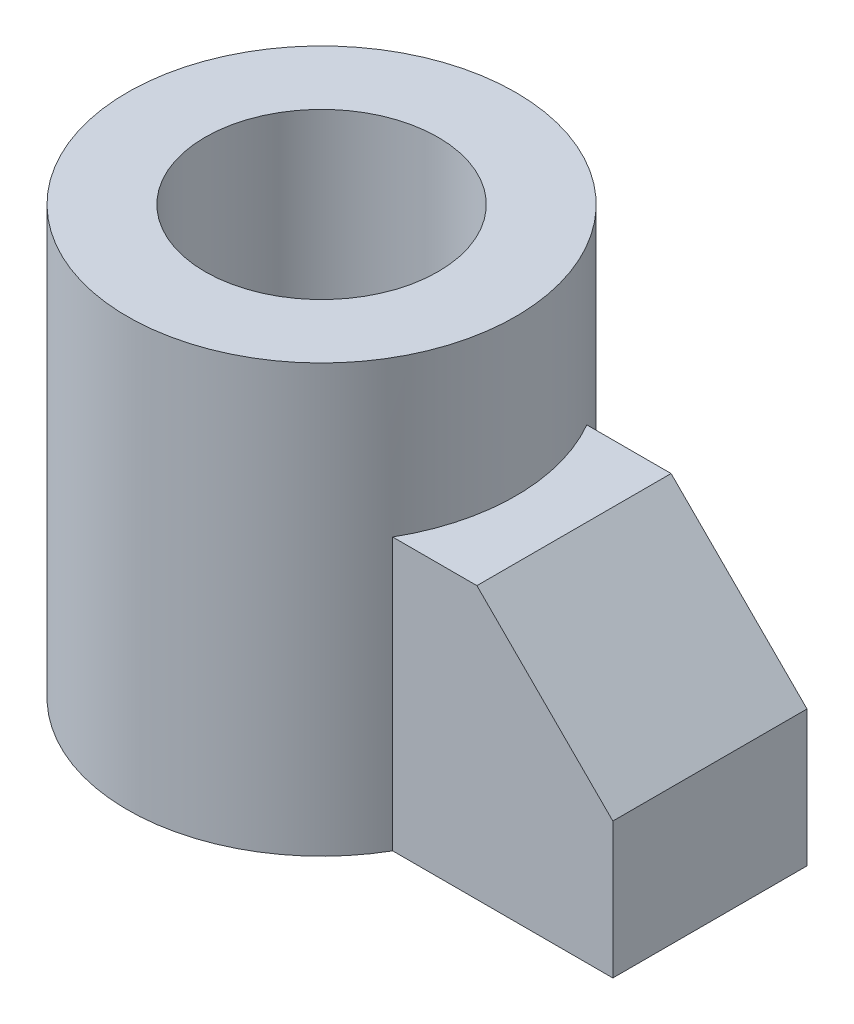
from build123d import *

# Parameters (mm, degrees)
SKETCH1_W           = 127
SKETCH1_H           = 63.5
BOSS_EXTRUDE1_DEPTH = 88.9
SKETCH3_R           = 63.5
BOSS_EXTRUDE2_DEPTH = 139.7
CUT_EXTRUDE1_REACH  = 213.465
CUT_EXTRUDE2_REACH  = 213.465
SKETCH5_R           = 38.1


with BuildPart() as part:
    # Sketch1 → Boss-Extrude1 (new body)
    with BuildSketch(Plane(origin=(0, 0, 0), x_dir=(1, 0, 0), z_dir=(0, 1, 0))):
        with Locations((63.5, 31.75)):
            Rectangle(SKETCH1_W, SKETCH1_H)
    extrude(amount=BOSS_EXTRUDE1_DEPTH)

    # Sketch3 → Boss-Extrude2 (add)
    with BuildSketch(Plane.XZ):
        with Locations(Location((0, -31.75, 0), (0, 0, 270))):
            Circle(SKETCH3_R)
    extrude(amount=-BOSS_EXTRUDE2_DEPTH)

    # Sketch4 → Cut-Extrude1 (cut, up to next)
    with BuildSketch(Plane.XY, mode=Mode.PRIVATE) as cut_extrude1_sk1:
        Polygon((82.55, 88.9), (127, 44.45), (127, 88.9), align=None)
    cut_extrude1_tool1 = extrude(cut_extrude1_sk1.sketch, amount=-CUT_EXTRUDE1_REACH, mode=Mode.PRIVATE) & part.part
    add(cut_extrude1_tool1.solids().sort_by_distance((112.183333, 74.083333, 0))[0], mode=Mode.SUBTRACT)

    # Sketch5 → Cut-Extrude2 (cut, up to next)
    with BuildSketch(Plane(origin=(0, 139.7, 0), x_dir=(1, 0, 0), z_dir=(0, 1, 0)), mode=Mode.PRIVATE) as cut_extrude2_sk1:
        with Locations(Location((0, 31.75, 0), (0, 0, 270))):
            Circle(SKETCH5_R)
    cut_extrude2_tool1 = extrude(cut_extrude2_sk1.sketch, amount=-CUT_EXTRUDE2_REACH, mode=Mode.PRIVATE) & part.part
    add(cut_extrude2_tool1.solids().sort_by_distance((0, 139.7, -31.75))[0], mode=Mode.SUBTRACT)


solid = part.part
